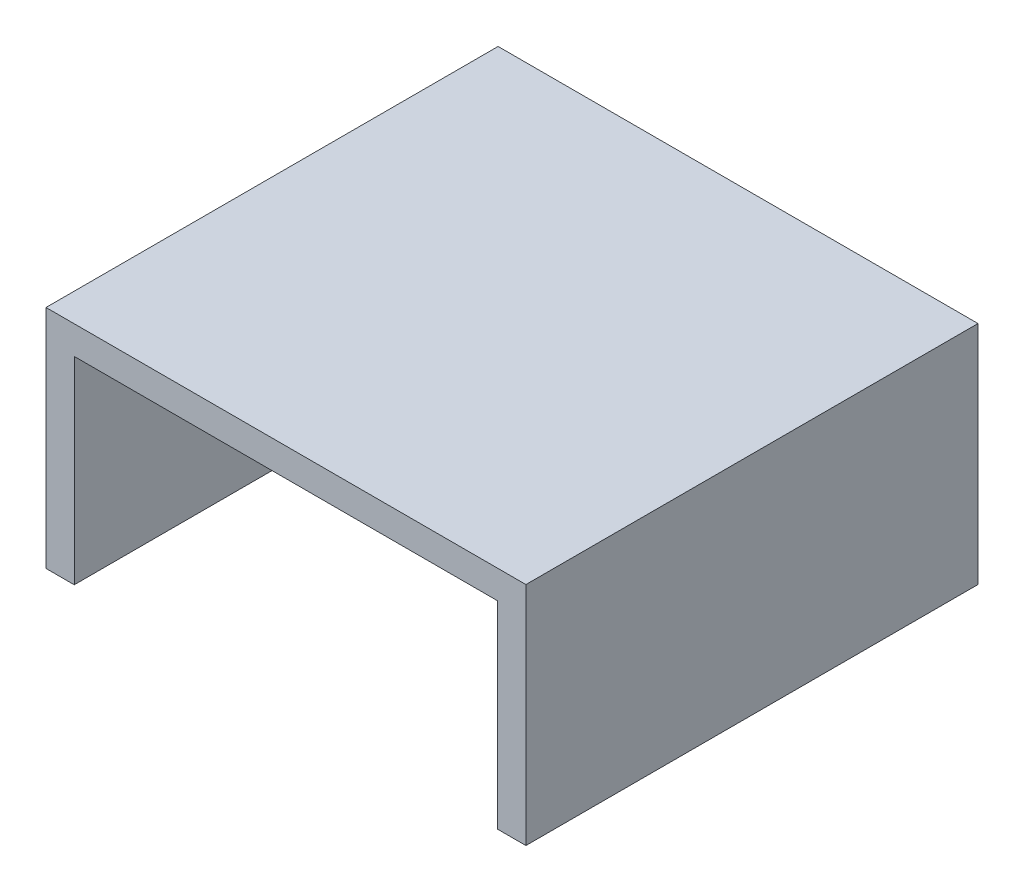
from build123d import *

# Parameters (mm, degrees)
BOSS_EXTRUDE1_DEPTH = 50.8


with BuildPart() as part:
    # Sketch1 → Boss-Extrude1 (new body)
    with BuildSketch(Plane.XY):
        Polygon((-26.9621, -22.225), (-26.9621, 3.175), (26.9621, 3.175), (26.9621, -22.225), (23.7871, -22.225), (23.7871, 0), (-23.7871, 0), (-23.7871, -22.225), align=None)
    extrude(amount=BOSS_EXTRUDE1_DEPTH)


solid = part.part
